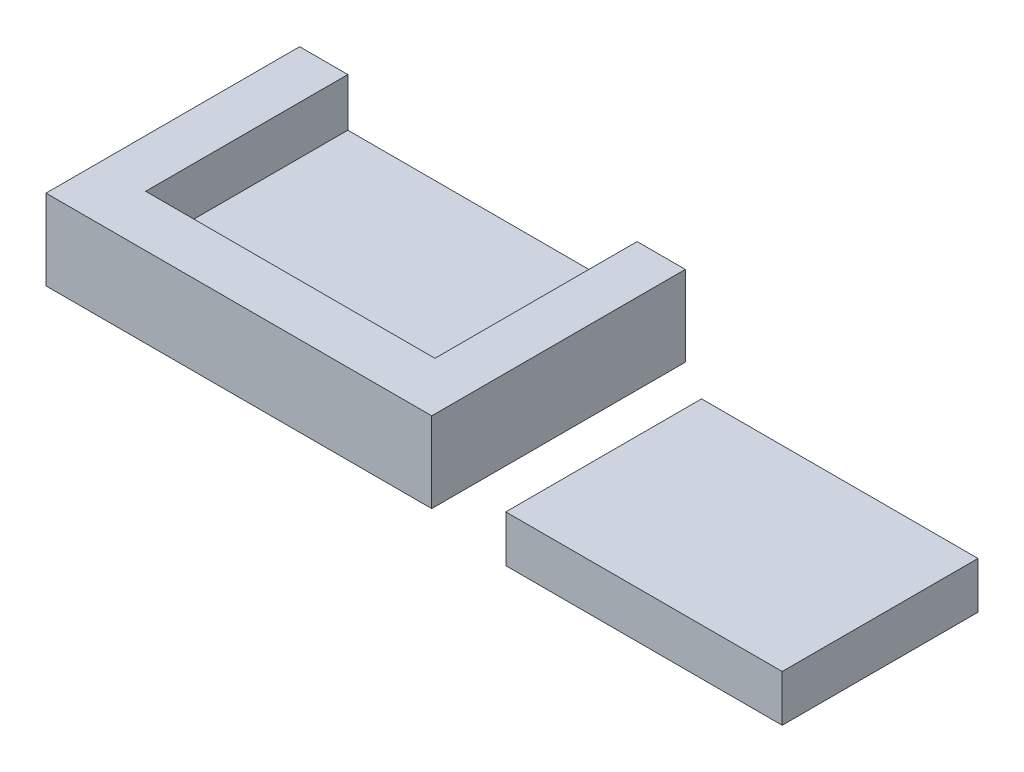
from build123d import *

# Parameters (mm, degrees)
SKETCH1_W           = 24
SKETCH1_H           = 15.78
BOSS_EXTRUDE1_DEPTH = 5
SKETCH2_W           = 18
SKETCH2_H           = 12.58
CUT_EXTRUDE1_DEPTH  = 3
SKETCH3_W           = 17.2
SKETCH3_H           = 12.182
BOSS_EXTRUDE2_DEPTH = 2.9


with BuildPart() as part:
    # Sketch1 → Boss-Extrude1 (new body)
    with BuildSketch(Plane(origin=(0, 0, 0), x_dir=(1, 0, 0), z_dir=(0, 1, 0))):
        with Locations((12, 7.89)):
            Rectangle(SKETCH1_W, SKETCH1_H)
    extrude(amount=BOSS_EXTRUDE1_DEPTH)

    # Sketch2 → Cut-Extrude1 (cut)
    with BuildSketch(Plane(origin=(0, 5, 0), x_dir=(1, 0, 0), z_dir=(0, 1, 0))):
        with Locations((12, 9.49)):
            Rectangle(SKETCH2_W, SKETCH2_H)
    extrude(amount=-CUT_EXTRUDE1_DEPTH, mode=Mode.SUBTRACT)


with BuildPart() as body_2:
    # Sketch3 → Boss-Extrude2 (new body)
    with BuildSketch(Plane(origin=(0, 0, 0), x_dir=(1, 0, 0), z_dir=(0, 1, 0))):
        with Locations((37.979647852, 5.318516785)):
            Rectangle(SKETCH3_W, SKETCH3_H)
    extrude(amount=BOSS_EXTRUDE2_DEPTH)


solid = Compound([part.part, body_2.part])
